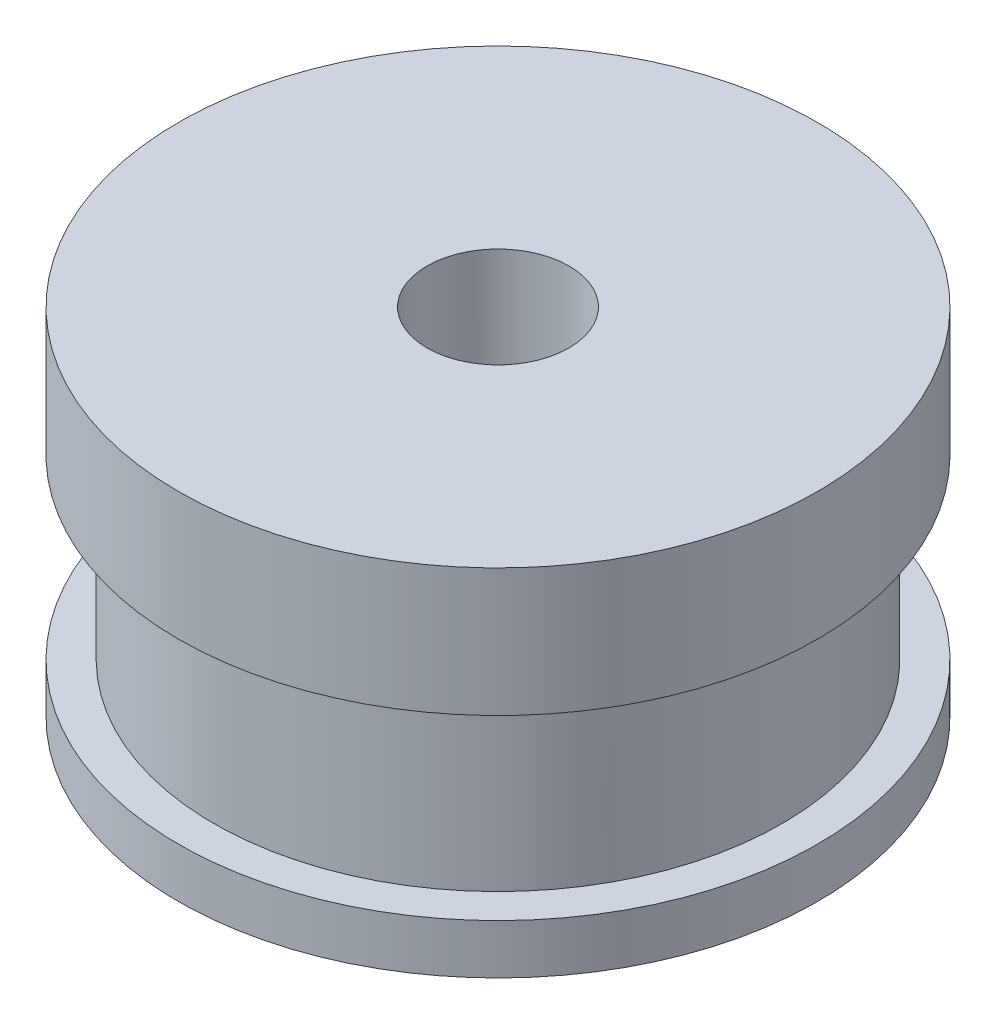
from build123d import *

# Parameters (mm, degrees)
ESQUISSE1_R        = 4
BOSS_EXTRU_1_DEPTH = 1.25
ESQUISSE2_R        = 4.5
BOSS_EXTRU_2_DEPTH = 1.8
BOSS_EXTRU_3_START = 0.7
ESQUISSE3_R        = 4.5
BOSS_EXTRU_3_DEPTH = 0.7


with BuildPart() as part:
    # Esquisse1 → Boss.-Extru.1 (new, symmetric)
    with BuildSketch(Plane(origin=(0, 0, 0), x_dir=(1, 0, 0), z_dir=(0, 1, 0))):
        with Locations(Location((0, 0, 0), (0, 0, 270))):
            Circle(ESQUISSE1_R)
    extrude(amount=BOSS_EXTRU_1_DEPTH, both=True)

    # Esquisse2 → Boss.-Extru.2 (add)
    with BuildSketch(Plane(origin=(0, 1.25, 0), x_dir=(1, 0, 0), z_dir=(0, 1, 0))):
        with Locations(Location((0, 0, 0), (0, 0, 270))):
            Circle(ESQUISSE2_R)
    extrude(amount=BOSS_EXTRU_2_DEPTH)

    # Esquisse3 → Boss.-Extru.3 (add)
    with BuildSketch(Plane(origin=(0, -1.25, 0), x_dir=(-1, 0, 0), z_dir=(0, -1, 0)).offset(BOSS_EXTRU_3_START)):
        with Locations(Location((0, 0, 0), (0, 0, 270))):
            Circle(ESQUISSE3_R)
    extrude(amount=-BOSS_EXTRU_3_DEPTH)

    # Esquisse4 → Perçage1 (revolve, cut)
    with BuildSketch(Plane(origin=(0, -1.95, 0), x_dir=(0, 0, -1), z_dir=(1, 0, 0))):
        Polygon((0, 0), (0, 10.600860619), (1, 10), (1, 1.600860619), (2, 1), (2, 0), align=None)
    revolve(axis=Axis((0, -8.080023899, 0), (0, 1, 0)), mode=Mode.SUBTRACT)


solid = part.part
